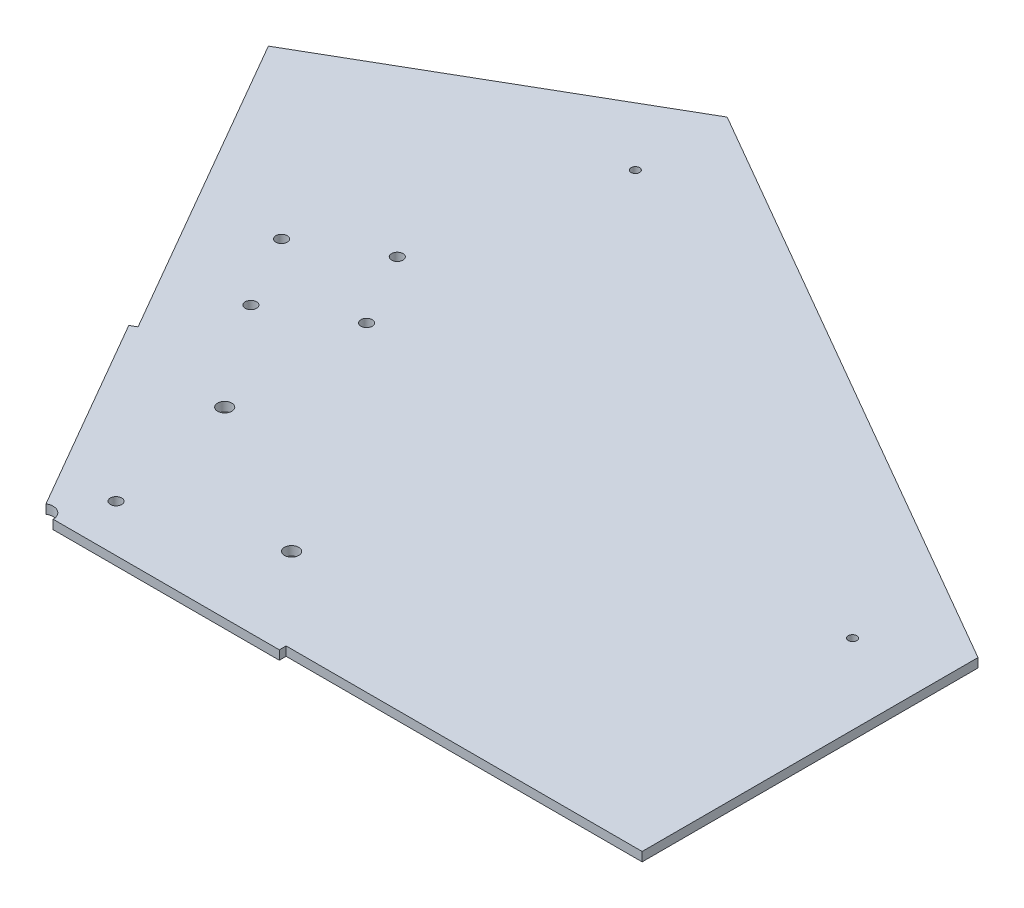
from build123d import *

# Parameters (mm, degrees)
BOSS_EXTRUDE1_DEPTH = 3.175
SKETCH2_R           = 2
SKETCH2_W           = 124.882271537
SKETCH2_H           = 4.7625
CUT_EXTRUDE1_DEPTH  = 319.019522016
SKETCH3_R           = 3.96875
CUT_EXTRUDE3_DEPTH  = 319.019522016
SKETCH5_R           = 2
CUT_EXTRUDE4_DEPTH  = 3.175
SKETCH7_R           = 2.5
CUT_EXTRUDE6_DEPTH  = 319.019522016
SKETCH8_R           = 1.5
CUT_EXTRUDE7_DEPTH  = 319.019522016
CUT_EXTRUDE5_DEPTH  = 3.175


with BuildPart() as part:
    # Sketch1 → Boss-Extrude1 (new body)
    with BuildSketch(Plane(origin=(0, 0, 0), x_dir=(1, 0, 0), z_dir=(0, 1, 0))):
        Polygon((-208.182271537, -120.194090512), (0, -240.388181024), (208.182271537, -120.194090512), (208.182271537, 120.194090512), (0, 240.388181024), (-208.182271537, 120.194090512), align=None)
    extrude(amount=BOSS_EXTRUDE1_DEPTH)

    # Sketch2 → Cut-Extrude1 (cut, through all)
    with BuildSketch(Plane(origin=(0, 3.175, 0), x_dir=(1, 0, 0), z_dir=(0, 1, 0))):
        Polygon((-106.153358761, 179.100510768), (-43.712222993, 70.949291135), (-39.587777007, 73.330541135), (-102.028912776, 181.481760768), align=None)
        with Locations(Location((99.6, -56.7055, 0), (0, 0, 270))):
            Circle(SKETCH2_R)
        with Locations(Location((129, -56.7055, 0), (0, 0, 270))):
            Circle(SKETCH2_R)
        with Locations(Location((129, -26.9875, 0), (0, 0, 270))):
            Circle(SKETCH2_R)
        with Locations(Location((99.6, -26.9875, 0), (0, 0, 270))):
            Circle(SKETCH2_R)
        with Locations(Location((-98.908403534, -57.903380217, 0), (0, 0, 270))):
            Circle(SKETCH2_R)
        with Locations(Location((-87.871860585, -98.223527088, 0), (0, 0, 270))):
            Circle(SKETCH2_R)
        with Locations(Location((-113.608403534, -83.364527088, 0), (0, 0, 270))):
            Circle(SKETCH2_R)
        Polygon((-102.028912776, -181.481760768), (-39.587777007, -73.330541135), (-43.712222993, -70.949291135), (-106.153358761, -179.100510768), align=None)
        with Locations(Location((-73.171860585, -72.762380217, 0), (0, 0, 270))):
            Circle(SKETCH2_R)
        with Locations(Location((-41.128139415, 125.211027088, 0), (0, 0, 270))):
            Circle(SKETCH2_R)
        with Locations(Location((-26.428139415, 99.749880217, 0), (0, 0, 270))):
            Circle(SKETCH2_R)
        with Locations((145.741135769, 0)):
            Rectangle(SKETCH2_W, SKETCH2_H)
        with Locations(Location((-15.391596466, 140.070027088, 0), (0, 0, 270))):
            Circle(SKETCH2_R)
        with Locations(Location((-0.691596466, 114.608880217, 0), (0, 0, 270))):
            Circle(SKETCH2_R)
    extrude(amount=-CUT_EXTRUDE1_DEPTH, mode=Mode.SUBTRACT)

    # Sketch3 → Cut-Extrude3 (cut, through all)
    with BuildSketch(Plane(origin=(0, 3.175, 0), x_dir=(1, 0, 0), z_dir=(0, 1, 0))):
        with Locations(Location((0, 0, 0), (0, 0, 270))):
            Circle(SKETCH3_R)
    extrude(amount=-CUT_EXTRUDE3_DEPTH, mode=Mode.SUBTRACT)

    # Sketch5 → Cut-Extrude4 (cut)
    with BuildSketch(Plane(origin=(0, 3.175, 0), x_dir=(1, 0, 0), z_dir=(0, 1, 0))):
        with Locations(Location((9.525, 16.497783942, 0), (0, 0, 270))):
            Circle(SKETCH5_R)
        with Locations(Location((9.525, -16.497783942, 0), (0, 0, 270))):
            Circle(SKETCH5_R)
        with Locations(Location((-19.05, 0, 0), (0, 0, 270))):
            Circle(SKETCH5_R)
    extrude(amount=-CUT_EXTRUDE4_DEPTH, mode=Mode.SUBTRACT)

    # Sketch7 → Cut-Extrude6 (cut, through all)
    with BuildSketch(Plane(origin=(0, 3.175, 0), x_dir=(1, 0, 0), z_dir=(0, 1, 0))):
        with Locations(Location((0, 64.13373, 0), (0, 0, 270))):
            Circle(SKETCH7_R)
        with Locations(Location((55.541439419, 32.066865, 0), (0, 0, 270))):
            Circle(SKETCH7_R)
        with Locations(Location((55.541439419, -32.066865, 0), (0, 0, 270))):
            Circle(SKETCH7_R)
        with Locations(Location((0, -64.13373, 0), (0, 0, 270))):
            Circle(SKETCH7_R)
        with Locations(Location((-55.541439419, -32.066865, 0), (0, 0, 270))):
            Circle(SKETCH7_R)
        with Locations(Location((-55.541439419, 32.066865, 0), (0, 0, 270))):
            Circle(SKETCH7_R)
    extrude(amount=-CUT_EXTRUDE6_DEPTH, mode=Mode.SUBTRACT)

    # Sketch8 → Cut-Extrude7 (cut, through all)
    with BuildSketch(Plane(origin=(0, 3.175, 0), x_dir=(1, 0, 0), z_dir=(0, 1, 0))):
        with BuildLine():
            ThreePointArc((181.791135768, 104.091135768), (181.740024508, 104.479364336), (181.590173874, 104.841135768))
            Line((181.590173874, 104.841135768), (180.291135768, 104.091135768))
            Line((180.291135768, 104.091135768), (181.041135768, 102.792097663))
            ThreePointArc((181.041135768, 102.792097663), (181.590173874, 103.341135768), (181.791135768, 104.091135768))
        make_face()
        with BuildLine():
            Line((180.291135768, 104.091135768), (181.590173874, 104.841135768))
            ThreePointArc((181.590173874, 104.841135768), (180.679364336, 105.540024508), (179.541135768, 105.390173874))
            Line((179.541135768, 105.390173874), (180.291135768, 104.091135768))
        make_face()
        with BuildLine():
            ThreePointArc((178.992097663, 103.341135768), (179.902907201, 102.642247029), (181.041135768, 102.792097663))
            Line((181.041135768, 102.792097663), (180.291135768, 104.091135768))
            Line((180.291135768, 104.091135768), (178.992097663, 103.341135768))
        make_face()
        with BuildLine():
            Line((180.291135768, 104.091135768), (179.541135768, 105.390173874))
            ThreePointArc((179.541135768, 105.390173874), (178.842247029, 104.479364336), (178.992097663, 103.341135768))
            Line((178.992097663, 103.341135768), (180.291135768, 104.091135768))
        make_face()
        with Locations(Location((0, -208.182271537, 0), (0, 0, 270))):
            Circle(SKETCH8_R)
        with Locations(Location((180.291135768, -104.091135768, 0), (0, 0, 270))):
            Circle(SKETCH8_R)
        with Locations(Location((0, 208.182271537, 0), (0, 0, 270))):
            Circle(SKETCH8_R)
        with Locations(Location((-180.291135768, -104.091135768, 0), (0, 0, 270))):
            Circle(SKETCH8_R)
        with Locations(Location((-180.291135768, 104.091135768, 0), (0, 0, 270))):
            Circle(SKETCH8_R)
    extrude(amount=-CUT_EXTRUDE7_DEPTH, mode=Mode.SUBTRACT)

    # Sketch6 → Cut-Extrude5 (cut)
    with BuildSketch(Plane(origin=(0, 3.175, 0), x_dir=(1, 0, 0), z_dir=(0, 1, 0))):
        with BuildLine():
            Line((0, 0), (-127, 219.970452561))
            ThreePointArc((-127, 219.970452561), (-127, -219.970452561), (254, 0))
            Line((254, 0), (0, 0))
        make_face()
    extrude(amount=-CUT_EXTRUDE5_DEPTH, mode=Mode.SUBTRACT)


solid = part.part
